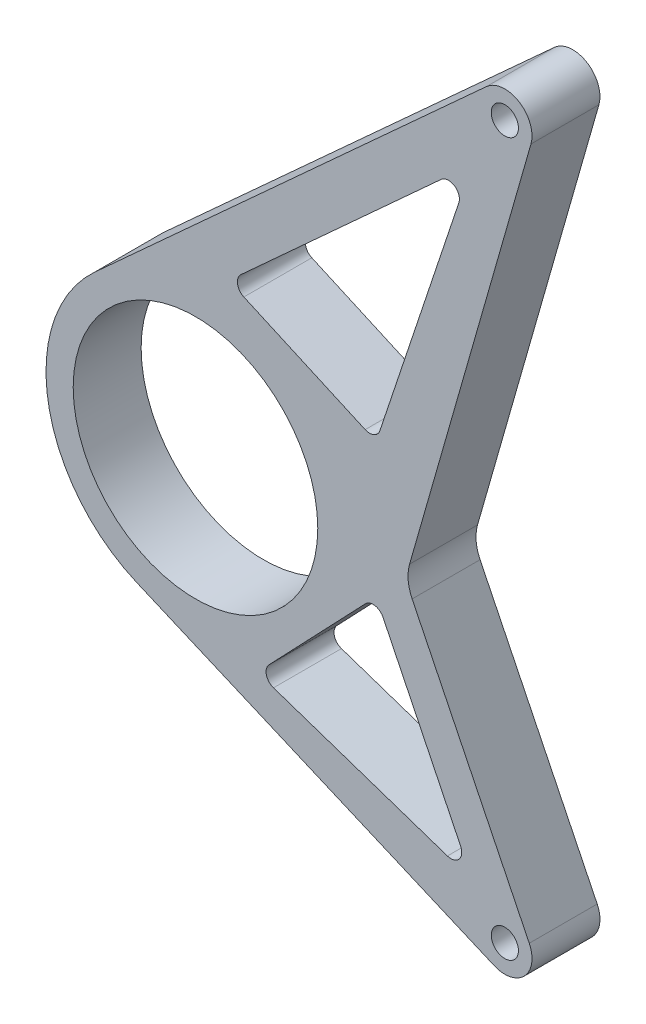
from build123d import *

# Parameters (mm, degrees)
SKETCH2_R           = 45
SKETCH2_R_2         = 5
BOSS_EXTRUDE2_DEPTH = 25
CUT_EXTRUDE1_DEPTH  = 25


with BuildPart() as part:
    # Sketch2 → Boss-Extrude2 (new body)
    with BuildSketch(Plane.XY):
        with BuildLine():
            Line((107.0991595, 171.84228244), (-37.020034505, 40.675755006))
            ThreePointArc((-37.020034505, 40.675755006), (-54.235521991, -9.138279618), (-21.647362352, -50.560772375))
            Line((-21.647362352, -50.560772375), (109.894190801, -106.879683889))
            ThreePointArc((109.894190801, -106.879683889), (121.07607209, -104.578515845), (122.814256533, -93.295406417))
            Line((122.814256533, -93.295406417), (79.717724854, -5.126210099))
            ThreePointArc((79.717724854, -5.126210099), (78.265617309, 0.093033065), (78.780622712, 5.485980771))
            Line((78.780622712, 5.485980771), (123.44478962, 161.697643481))
            ThreePointArc((123.44478962, 161.697643481), (119.103356541, 172.943307617), (107.0991595, 171.84228244))
        make_face()
        Circle(SKETCH2_R, mode=Mode.SUBTRACT)
        with Locations((113.830074865, -97.686816185)):
            Circle(SKETCH2_R_2, mode=Mode.SUBTRACT)
        with Locations((113.830074865, 164.446690621)):
            Circle(SKETCH2_R_2, mode=Mode.SUBTRACT)
    extrude(amount=BOSS_EXTRUDE2_DEPTH)

    # Sketch3 → Cut-Extrude1 (cut)
    with BuildSketch(Plane.XY.offset(25)):
        with BuildLine():
            Line((17.795721205, 60.121434904), (62.437923836, 40.184140526))
            ThreePointArc((62.437923836, 40.184140526), (65.680023373, 40.175202237), (67.86378835, 42.571545249))
            Line((67.86378835, 42.571545249), (96.902891032, 129.688853296))
            ThreePointArc((96.902891032, 129.688853296), (95.288982132, 134.306972586), (90.41314241, 133.909587735))
            Line((90.41314241, 133.909587735), (16.731837096, 66.729574067))
            ThreePointArc((16.731837096, 66.729574067), (15.477705501, 63.137953736), (17.795721205, 60.121434904))
        make_face()
        with BuildLine():
            Line((27.085895713, -52.406577788), (62.496309368, -15.289638174))
            ThreePointArc((62.496309368, -15.289638174), (66.005561811, -14.098322429), (68.98684583, -16.2996928))
            Line((68.98684583, -16.2996928), (97.571155647, -75.006771443))
            ThreePointArc((97.571155647, -75.006771443), (96.977969452, -79.399977656), (92.696111536, -80.547942587))
            Line((92.696111536, -80.547942587), (28.701388064, -58.957803557))
            ThreePointArc((28.701388064, -58.957803557), (26.096410491, -56.125376983), (27.085895713, -52.406577788))
        make_face()
    extrude(amount=-CUT_EXTRUDE1_DEPTH, mode=Mode.SUBTRACT)


solid = part.part
